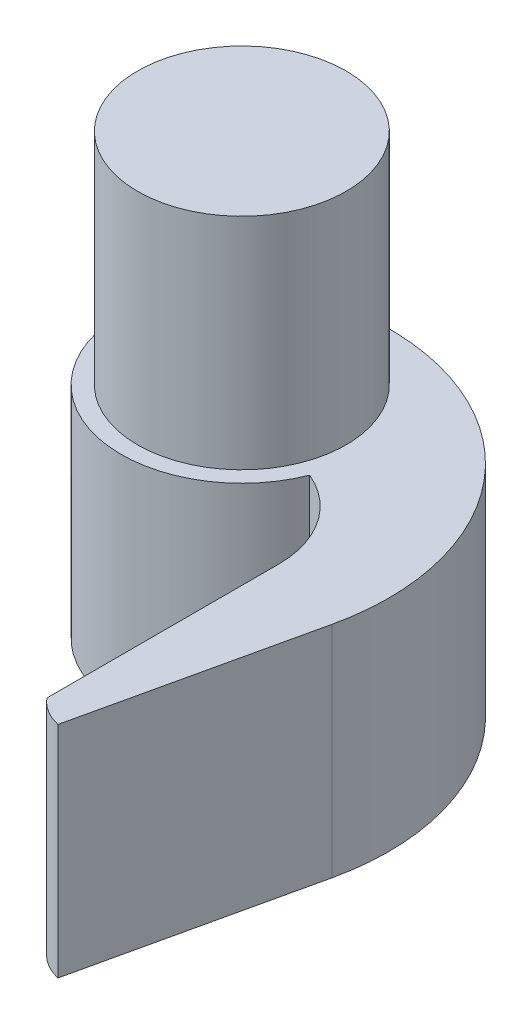
from build123d import *

# Parameters (mm, degrees)
BOSS_EXTRUDE1_DEPTH = 20
SKETCH4_R           = 9.5
BOSS_EXTRUDE2_DEPTH = 20


with BuildPart() as part:
    # Sketch1 → Boss-Extrude1 (new body)
    with BuildSketch(Plane(origin=(0, 0, 0), x_dir=(1, 0, 0), z_dir=(0, 1, 0))):
        with BuildLine():
            Line((18.424541272, -35.177357689), (23.005994318, -14.800530945))
            ThreePointArc((23.005994318, -14.800530945), (18.132040633, 4.01076546), (0, 11))
            ThreePointArc((0, 11), (-9.097635455, -6.183286273), (10.227869895, -4.048540158))
            ThreePointArc((10.227869895, -4.048540158), (14.304101202, -7.422369294), (15.833057178, -12.488006305))
            Line((15.833057178, -12.488006305), (15.833057178, -33.589930418))
            ThreePointArc((15.833057178, -33.589930418), (16.997270485, -34.598365473), (18.424541272, -35.177357689))
        make_face()
    extrude(amount=BOSS_EXTRUDE1_DEPTH)

    # Sketch4 → Boss-Extrude2 (add)
    with BuildSketch(Plane(origin=(0, 20, 0), x_dir=(1, 0, 0), z_dir=(0, 1, 0))):
        with Locations(Location((0, 0, 0), (0, 0, 90))):
            Circle(SKETCH4_R)
    extrude(amount=BOSS_EXTRUDE2_DEPTH)


solid = part.part
